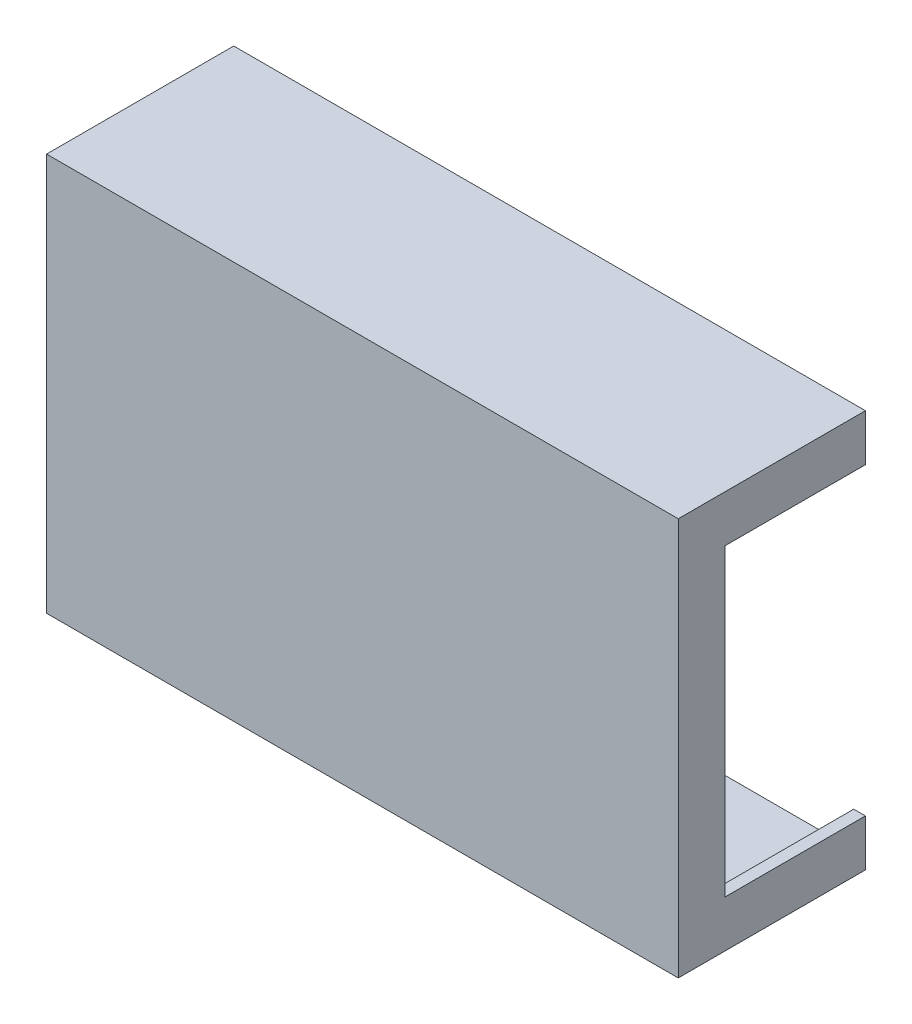
from build123d import *

# Parameters (mm, degrees)
SKETCH_1_W               = 270
SKETCH_1_H               = 170
EXTRUDE_1_DEPTH          = 10
SKETCH_3_W               = 270
SKETCH_3_H               = 170
SKETCH_3_W_2             = 260
SKETCH_3_H_2             = 160
EXTRUDE_2_DEPTH          = 70
CUT_EXTRUDE_1_DEPTH      = 292.590466236
CUT_EXTRUDE_1_DEPTH_BACK = 292.590466236
SKETCH_4_W               = 60
SKETCH_4_H               = 130


with BuildPart() as part:
    # 草图1 → 凸台-拉伸1 (new body)
    with BuildSketch(Plane.XY):
        Rectangle(SKETCH_1_W, SKETCH_1_H)
    extrude(amount=EXTRUDE_1_DEPTH)

    # 草图3 → 凸台-拉伸2 (add)
    with BuildSketch(Plane(origin=(0, 0, 0), x_dir=(-1, 0, 0), z_dir=(0, 0, -1))):
        Rectangle(SKETCH_3_W, SKETCH_3_H)
        Rectangle(SKETCH_3_W_2, SKETCH_3_H_2, mode=Mode.SUBTRACT)
    extrude(amount=EXTRUDE_2_DEPTH)

    # 草图4 → 切除-拉伸1 (cut, two sides: drawn at the far end of the back side and taken through both)
    with BuildSketch(Plane(origin=(135, 0, 0), x_dir=(0, 0, -1), z_dir=(1, 0, 0)).offset(-CUT_EXTRUDE_1_DEPTH_BACK)):
        with Locations((40, 0)):
            Rectangle(SKETCH_4_W, SKETCH_4_H)
    extrude(amount=CUT_EXTRUDE_1_DEPTH + CUT_EXTRUDE_1_DEPTH_BACK, mode=Mode.SUBTRACT)


solid = part.part
